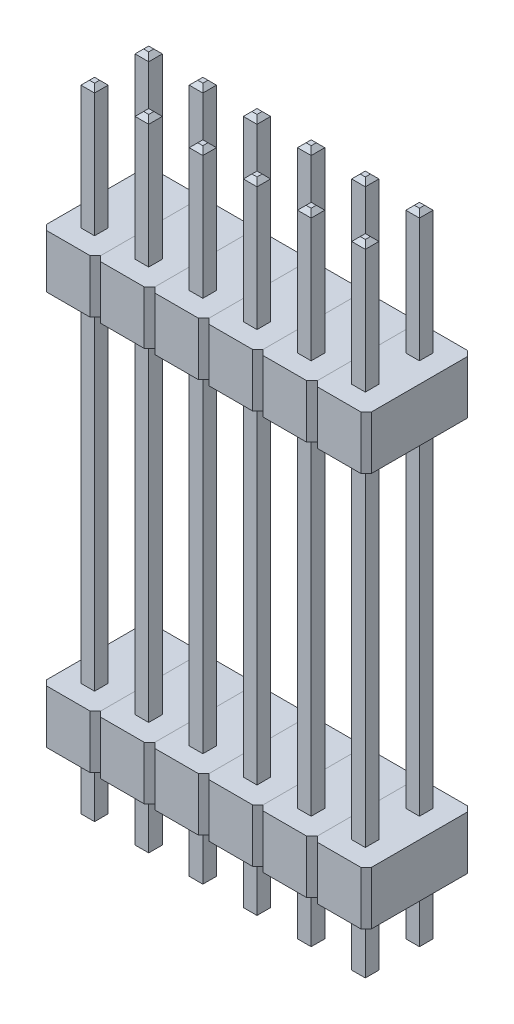
from build123d import *

# Parameters (mm, degrees)
EXTRUDE_1_DEPTH        = 2.5
PATTERN_LINEAR_1_COUNT = 2
PATTERN_LINEAR_1_PITCH = 18.5
EXTRUDE_START          = -27
SKETCH_2_W             = 0.64
SKETCH_2_H             = 0.64
EXTRUDE_2_DEPTH        = 30
CHAMFER_1_SIZE         = 0.2
PATTERN_LINEAR_2_COUNT = 2
PATTERN_LINEAR_2_PITCH = 2.54
PATTERN_LINEAR_3_COUNT = 6
PATTERN_LINEAR_3_PITCH = 2.54


with BuildPart() as part:
    # Эскиз1 → Бобышка-Вытянуть1 (new body)
    with BuildSketch(Plane(origin=(0, 0, 0), x_dir=(1, 0, 0), z_dir=(0, 1, 0))):
        Polygon((-1.27, 0.98), (-1.02, 1.23), (1.02, 1.23), (1.27, 0.98), (1.27, -3.52), (1.02, -3.77), (-1.02, -3.77), (-1.27, -3.52), align=None)
    extrude(amount=EXTRUDE_1_DEPTH)


with BuildPart() as pattern_linear_1_1:
    # Линейный массив1: pattern copy
    add(part.part.moved(Location(Vector(0, 1, 0) * (1 * PATTERN_LINEAR_1_PITCH))))


with BuildPart() as body_3:
    # Эскиз2 → Бобышка-Вытянуть2 (new body)
    with BuildSketch(Plane.XZ.offset(EXTRUDE_START)):
        Rectangle(SKETCH_2_W, SKETCH_2_H)
    extrude(amount=EXTRUDE_2_DEPTH)

    # Фаска1
    chamfer_1_edges = [body_3.edges().sort_by_distance(p)[0] for p in [
        (0.32, 27, 0),
        (-0.32, -3, 0),
        (0, -3, -0.32),
        (0, 27, 0.32),
        (0.32, -3, 0),
        (0, -3, 0.32),
        (-0.32, 27, 0),
        (0, 27, -0.32),
    ]]
    chamfer(chamfer_1_edges, length=CHAMFER_1_SIZE)


with BuildPart() as pattern_linear_2_1:
    # Линейный массив2: pattern copy
    add(body_3.part.moved(Location(Vector(0, 0, 1) * (1 * PATTERN_LINEAR_2_PITCH))))


with BuildPart() as pattern_linear_3_1:
    # Линейный массив3: pattern copy
    add(part.part.moved(Location(Vector(1, 0, 0) * (1 * PATTERN_LINEAR_3_PITCH))))


with BuildPart() as pattern_linear_3_2:
    # Линейный массив3: pattern copy
    add(part.part.moved(Location(Vector(1, 0, 0) * (2 * PATTERN_LINEAR_3_PITCH))))


with BuildPart() as pattern_linear_3_3:
    # Линейный массив3: pattern copy
    add(part.part.moved(Location(Vector(1, 0, 0) * (3 * PATTERN_LINEAR_3_PITCH))))


with BuildPart() as pattern_linear_3_4:
    # Линейный массив3: pattern copy
    add(part.part.moved(Location(Vector(1, 0, 0) * (4 * PATTERN_LINEAR_3_PITCH))))


with BuildPart() as pattern_linear_3_5:
    # Линейный массив3: pattern copy
    add(part.part.moved(Location(Vector(1, 0, 0) * (5 * PATTERN_LINEAR_3_PITCH))))


with BuildPart() as pattern_linear_3_6:
    # Линейный массив3: pattern copy
    add(pattern_linear_1_1.part.moved(Location(Vector(1, 0, 0) * (1 * PATTERN_LINEAR_3_PITCH))))


with BuildPart() as pattern_linear_3_7:
    # Линейный массив3: pattern copy
    add(pattern_linear_1_1.part.moved(Location(Vector(1, 0, 0) * (2 * PATTERN_LINEAR_3_PITCH))))


with BuildPart() as pattern_linear_3_8:
    # Линейный массив3: pattern copy
    add(pattern_linear_1_1.part.moved(Location(Vector(1, 0, 0) * (3 * PATTERN_LINEAR_3_PITCH))))


with BuildPart() as pattern_linear_3_9:
    # Линейный массив3: pattern copy
    add(pattern_linear_1_1.part.moved(Location(Vector(1, 0, 0) * (4 * PATTERN_LINEAR_3_PITCH))))


with BuildPart() as pattern_linear_3_10:
    # Линейный массив3: pattern copy
    add(pattern_linear_1_1.part.moved(Location(Vector(1, 0, 0) * (5 * PATTERN_LINEAR_3_PITCH))))


with BuildPart() as pattern_linear_3_11:
    # Линейный массив3: pattern copy
    add(pattern_linear_2_1.part.moved(Location(Vector(1, 0, 0) * (1 * PATTERN_LINEAR_3_PITCH))))


with BuildPart() as pattern_linear_3_12:
    # Линейный массив3: pattern copy
    add(pattern_linear_2_1.part.moved(Location(Vector(1, 0, 0) * (2 * PATTERN_LINEAR_3_PITCH))))


with BuildPart() as pattern_linear_3_13:
    # Линейный массив3: pattern copy
    add(pattern_linear_2_1.part.moved(Location(Vector(1, 0, 0) * (3 * PATTERN_LINEAR_3_PITCH))))


with BuildPart() as pattern_linear_3_14:
    # Линейный массив3: pattern copy
    add(pattern_linear_2_1.part.moved(Location(Vector(1, 0, 0) * (4 * PATTERN_LINEAR_3_PITCH))))


with BuildPart() as pattern_linear_3_15:
    # Линейный массив3: pattern copy
    add(pattern_linear_2_1.part.moved(Location(Vector(1, 0, 0) * (5 * PATTERN_LINEAR_3_PITCH))))


with BuildPart() as pattern_linear_3_16:
    # Линейный массив3: pattern copy
    add(body_3.part.moved(Location(Vector(1, 0, 0) * (1 * PATTERN_LINEAR_3_PITCH))))


with BuildPart() as pattern_linear_3_17:
    # Линейный массив3: pattern copy
    add(body_3.part.moved(Location(Vector(1, 0, 0) * (2 * PATTERN_LINEAR_3_PITCH))))


with BuildPart() as pattern_linear_3_18:
    # Линейный массив3: pattern copy
    add(body_3.part.moved(Location(Vector(1, 0, 0) * (3 * PATTERN_LINEAR_3_PITCH))))


with BuildPart() as pattern_linear_3_19:
    # Линейный массив3: pattern copy
    add(body_3.part.moved(Location(Vector(1, 0, 0) * (4 * PATTERN_LINEAR_3_PITCH))))


with BuildPart() as pattern_linear_3_20:
    # Линейный массив3: pattern copy
    add(body_3.part.moved(Location(Vector(1, 0, 0) * (5 * PATTERN_LINEAR_3_PITCH))))


solid = Compound([part.part, pattern_linear_1_1.part, body_3.part, pattern_linear_2_1.part, pattern_linear_3_1.part, pattern_linear_3_2.part, pattern_linear_3_3.part, pattern_linear_3_4.part, pattern_linear_3_5.part, pattern_linear_3_6.part, pattern_linear_3_7.part, pattern_linear_3_8.part, pattern_linear_3_9.part, pattern_linear_3_10.part, pattern_linear_3_11.part, pattern_linear_3_12.part, pattern_linear_3_13.part, pattern_linear_3_14.part, pattern_linear_3_15.part, pattern_linear_3_16.part, pattern_linear_3_17.part, pattern_linear_3_18.part, pattern_linear_3_19.part, pattern_linear_3_20.part])
